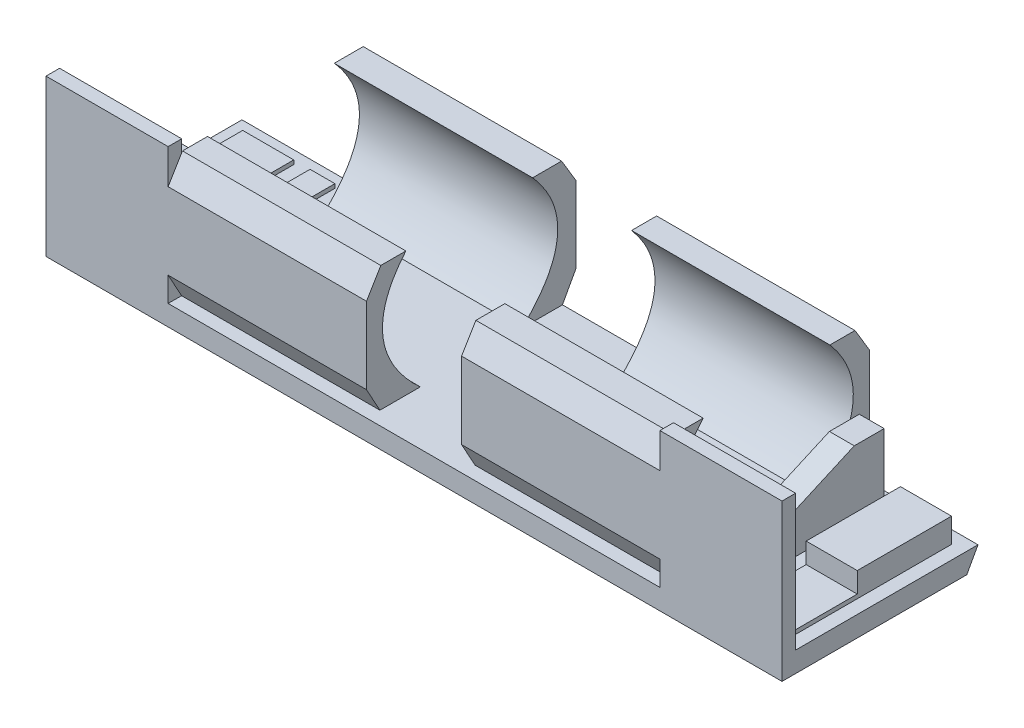
from build123d import *

# Parameters (mm, degrees)
SKETCH_1_W               = 3.76
SKETCH_1_H               = 11.54
SKETCH_1_W_2             = 1.83
SKETCH_1_W_3             = 14.6
SKETCH_1_H_2             = 2.72
SKETCH_1_H_3             = 6.9
EXTRUDE_1_DEPTH          = 1
SKETCH_1_3_W             = 3.76
SKETCH_1_3_H             = 11.54
SKETCH_1_3_W_2           = 1.83
SKETCH_1_3_W_3           = 14.6
SKETCH_1_3_H_2           = 2.72
EXTRUDE_2_DEPTH          = 10
EXTRUDE_3_DEPTH          = 14.6
CUT_EXTRUDE_1_DEPTH      = 14.6
CUT_EXTRUDE_2_DEPTH      = 14.6
CUT_EXTRUDE_3_DEPTH      = 14.6
PATTERN_CIRCULAR_1_COUNT = 2
SKETCH_7_W               = 20.64829466
SKETCH_7_H               = 2.860597992
CUT_EXTRUDE_4_DEPTH      = 38.6
SKETCH_8_W               = 54.18
SKETCH_8_H               = 19.048575036
SKETCH_8_W_2             = 7
SKETCH_8_H_2             = 4.5
SKETCH_8_R               = 1.6
EXTRUDE_4_DEPTH          = 1.5
SKETCH_9_W               = 54.18
SKETCH_9_H               = 1.8
EXTRUDE_5_DEPTH          = 7
SKETCH_10_R              = 1.65
CUT_EXTRUDE_5_DEPTH      = 5
EXTRUDE_START            = 2
SKETCH_8_3_W             = 7
SKETCH_8_3_H             = 4.5
SKETCH_8_3_R             = 1.6
EXTRUDE_6_DEPTH          = 2
SKETCH_11_W              = 54.18
SKETCH_11_H              = 6.653379434
CUT_EXTRUDE_6_DEPTH      = 5
CUT_EXTRUDE_7_DEPTH      = 54.18
SKETCH_13_W              = 8.99
SKETCH_13_H              = 1
EXTRUDE_7_DEPTH          = 10


with BuildPart() as part:
    # 草图1 → 凸台-拉伸1 (new body)
    # profile 1 of 6: a face of its own
    with BuildSketch(Plane(origin=(0, 0, 0), x_dir=(1, 0, 0), z_dir=(0, 1, 0))):
        Polygon((-7.603, 6.17), (-7.603, -6.17), (1.387, -6.17), (1.387, -3.45), (1.387, 3.45), (1.387, 6.17), align=None)
        with Locations((-4.723, 0)):
            Rectangle(SKETCH_1_W, SKETCH_1_H, mode=Mode.SUBTRACT)
        with Locations((-0.728, 0)):
            Rectangle(SKETCH_1_W_2, SKETCH_1_H, mode=Mode.SUBTRACT)
    # profile 2 of 6: a face of its own
    with BuildSketch(Plane(origin=(0, 0, 0), x_dir=(1, 0, 0), z_dir=(0, 1, 0))):
        with Locations((8.687, -4.81)):
            Rectangle(SKETCH_1_W_3, SKETCH_1_H_2)
    # profile 3 of 6: a face of its own
    with BuildSketch(Plane(origin=(0, 0, 0), x_dir=(1, 0, 0), z_dir=(0, 1, 0))):
        with Locations((8.687, 0)):
            Rectangle(SKETCH_1_W_3, SKETCH_1_H_3)
    # profile 4 of 6: a face of its own
    with BuildSketch(Plane(origin=(0, 0, 0), x_dir=(1, 0, 0), z_dir=(0, 1, 0))):
        with Locations((8.687, 4.81)):
            Rectangle(SKETCH_1_W_3, SKETCH_1_H_2)
    # profile 5 of 6: a face of its own
    with BuildSketch(Plane(origin=(0, 0, 0), x_dir=(1, 0, 0), z_dir=(0, 1, 0))):
        with Locations((-4.723, 0)):
            Rectangle(SKETCH_1_W, SKETCH_1_H)
    # profile 6 of 6: a face of its own
    with BuildSketch(Plane(origin=(0, 0, 0), x_dir=(1, 0, 0), z_dir=(0, 1, 0))):
        with Locations((-0.728, 0)):
            Rectangle(SKETCH_1_W_2, SKETCH_1_H)
    extrude(amount=-EXTRUDE_1_DEPTH)

    # 草图1<3> → 凸台-拉伸2 (add)
    with BuildSketch(Plane(origin=(0, 0, 0), x_dir=(1, 0, 0), z_dir=(0, 1, 0))):
        with Locations((-4.723, 0)):
            Rectangle(SKETCH_1_3_W, SKETCH_1_3_H)
        with Locations((-0.728, 0)):
            Rectangle(SKETCH_1_3_W_2, SKETCH_1_3_H)
        with Locations((8.687, -4.81)):
            Rectangle(SKETCH_1_3_W_3, SKETCH_1_3_H_2)
        with Locations((8.687, 4.81)):
            Rectangle(SKETCH_1_3_W_3, SKETCH_1_3_H_2)
    extrude(amount=EXTRUDE_2_DEPTH)

    # 草图4 → 凸台-拉伸3 (add)
    with BuildSketch(Plane(origin=(15.987, 0, 0), x_dir=(0, 0, -1), z_dir=(1, 0, 0))):
        Polygon((6.17, 10), (7.707580576, 7.443577481), (7.707580576, 1.805314446), (6.17, -1), align=None)
        Polygon((-7.707580576, 1.805314446), (-6.17, -1), (-6.17, 10), (-7.707580576, 7.443577481), align=None)
    extrude(amount=-EXTRUDE_3_DEPTH)

    # 草图3 → 切除-拉伸1 (cut)
    with BuildSketch(Plane(origin=(15.987, 0, 0), x_dir=(0, 0, -1), z_dir=(1, 0, 0))):
        with BuildLine():
            Line((3.45, 0), (3.743222721, 0))
            add(Edge.make_bspline(
                [(3.743222721, 0), (3.911611309, 0.15963804), (4.29393083, 0.539845441), (4.994683036, 1.333496486), (5.723480991, 2.402845903), (6.251271172, 3.695549278), (6.429364414, 5), (6.251271172, 6.304450722), (5.723480991, 7.597154097), (4.994683036, 8.666503514), (4.253106755, 9.506390689), (3.815688064, 9.935054209), (3.597380816, 10.136172737)],
                knots=[0.014828564, 0.014828564, 0.014828564, 0.014828564, 0.0625, 0.125, 0.25, 0.375, 0.5, 0.625, 0.75, 0.875, 0.9375, 0.998871937, 0.998871937, 0.998871937, 0.998871937], degree=3))
            Line((3.597380816, 10.136172737), (3.45, 10))
            Line((3.45, 10), (3.45, 0))
        make_face()
        with BuildLine():
            Line((-3.45, 0), (-3.743222721, 0))
            add(Edge.make_bspline(
                [(-3.743222721, 0), (-3.781981306, 0.035623699), (-3.849464206, 0.098316559), (-4.072000203, 0.30899054), (-4.461726475, 0.698324492), (-5.152564834, 1.48074741), (-5.881362789, 2.550096827), (-6.40915297, 3.842800202), (-6.587246212, 5.147250924), (-6.40915297, 6.451701646), (-5.881362789, 7.744405021), (-5.152564834, 8.813754438), (-4.461708764, 9.596197415), (-4.071967827, 9.985543512), (-3.84942965, 10.196217487), (-3.781968617, 10.258889811), (-3.743222721, 10.294501848)],
                knots=[0, 0, 0, 0, 0.010893382, 0.018155637, 0.0625, 0.125, 0.25, 0.375, 0.5, 0.625, 0.75, 0.875, 0.9375, 0.981850307, 0.989110184, 1, 1, 1, 1], degree=3))
            Line((-3.743222721, 10.294501848), (-3.45, 10))
            Line((-3.45, 10), (-3.45, 0))
        make_face()
    extrude(amount=-CUT_EXTRUDE_1_DEPTH, mode=Mode.SUBTRACT)

    # 草图5 → 切除-拉伸2 (cut)
    with BuildSketch(Plane(origin=(0.187, 0, 0), x_dir=(0, 0, -1), z_dir=(1, 0, 0))):
        Polygon((1.17, 2.8), (-3.569711506, 4.901860767), (-5.77, 4.901860767), (-5.77, 10), (5.77, 10), (5.77, 0.3), (1.17, 0.3), align=None)
    extrude(amount=-CUT_EXTRUDE_2_DEPTH, mode=Mode.SUBTRACT)

    # 草图6 → 切除-拉伸3 (cut)
    with BuildSketch(Plane(origin=(-2.843, 0, 0), x_dir=(0, 0, -1), z_dir=(1, 0, 0))):
        Polygon((1.17, 5.538552109), (1.17, 1.8), (-3.795527251, 1.8), (-5.77, 1.8), (-5.77, 5.538552109), align=None)
    extrude(amount=-CUT_EXTRUDE_3_DEPTH, mode=Mode.SUBTRACT)


with BuildPart() as pattern_circular_1_1:
    # 阵列(圆周)1: pattern copy
    add(part.part.rotate(Axis((19.487, -1.5500525, 0), (0, 1, 0)), 1 * 360 / PATTERN_CIRCULAR_1_COUNT))


with BuildPart() as cut_extrude_4_tool:
    # 草图7 → 切除-拉伸4 (new body)
    with BuildSketch(Plane.ZY.offset(-1.387)):
        with Locations((-0.112362095, 10.62761907)):
            Rectangle(SKETCH_7_W, SKETCH_7_H)
    extrude(amount=-CUT_EXTRUDE_4_DEPTH)


with BuildPart() as part_1:
    add(part.part)

    # 切除-拉伸4: cut by cut_extrude_4_tool
    add(cut_extrude_4_tool.part, mode=Mode.SUBTRACT)



with BuildPart() as pattern_circular_1_1_1:
    add(pattern_circular_1_1.part)

    # 切除-拉伸4: cut by cut_extrude_4_tool
    add(cut_extrude_4_tool.part, mode=Mode.SUBTRACT)


with BuildPart() as part_2:
    add(part_1.part)

    add(pattern_circular_1_1_1.part)  # 凸台-拉伸4 merges 阵列(圆周)1_1
    # 草图8 → 凸台-拉伸4 (add)
    # profile 1 of 2: a face of its own
    with BuildSketch(Plane(origin=(0, 0, 0), x_dir=(1, 0, 0), z_dir=(0, 1, 0))):
        with Locations((19.487, 0)):
            Rectangle(SKETCH_8_W, SKETCH_8_H)
    # profile 2 of 2: a face of its own
    with BuildSketch(Plane(origin=(0, 0, 0), x_dir=(1, 0, 0), z_dir=(0, 1, 0))):
        with Locations((19.487, -11.774287518)):
            Rectangle(SKETCH_8_W_2, SKETCH_8_H_2)
        with Locations(Location((19.487, -11.774287518, 0), (0, 0, 270))):
            Circle(SKETCH_8_R, mode=Mode.SUBTRACT)
    extrude(amount=-EXTRUDE_4_DEPTH)

    # 草图9 → 凸台-拉伸5 (add)
    with BuildSketch(Plane(origin=(0, 0, 0), x_dir=(1, 0, 0), z_dir=(0, 1, 0))):
        with Locations((19.487, 8.624287518)):
            Rectangle(SKETCH_9_W, SKETCH_9_H)
    extrude(amount=EXTRUDE_5_DEPTH)

    # 草图10 → 切除-拉伸5 (cut)
    with BuildSketch(Plane.XY.offset(-7.724287518)):
        with Locations((-4.603, 2.5)):
            Circle(SKETCH_10_R)
        with Locations((43.577, 2.5)):
            Circle(SKETCH_10_R)
    extrude(amount=-CUT_EXTRUDE_5_DEPTH, mode=Mode.SUBTRACT)

    # 草图8<3> → 凸台-拉伸6 (add)
    with BuildSketch(Plane(origin=(0, 0, 0), x_dir=(1, 0, 0), z_dir=(0, 1, 0)).offset(EXTRUDE_START)):
        with Locations((19.487, -11.774287518)):
            Rectangle(SKETCH_8_3_W, SKETCH_8_3_H)
        with Locations(Location((19.487, -11.774287518, 0), (0, 0, 270))):
            Circle(SKETCH_8_3_R, mode=Mode.SUBTRACT)
    extrude(amount=-EXTRUDE_6_DEPTH)

    # 草图11 → 切除-拉伸6 (cut, symmetric)
    with BuildSketch(Plane(origin=(0, 0, 0), x_dir=(1, 0, 0), z_dir=(0, 1, 0))):
        with Locations((19.487, -11.034270293)):
            Rectangle(SKETCH_11_W, SKETCH_11_H)
    extrude(amount=CUT_EXTRUDE_6_DEPTH, both=True, mode=Mode.SUBTRACT)

    # 草图12 → 切除-拉伸7 (cut)
    with BuildSketch(Plane(origin=(46.577, 0, 0), x_dir=(0, 0, -1), z_dir=(1, 0, 0))):
        Polygon((7.707580576, 1.805314446), (5.895952187, -1.5), (9.524287518, -1.5), (9.524287518, 7.146168792), (7.724287518, 7), align=None)
    extrude(amount=-CUT_EXTRUDE_7_DEPTH, mode=Mode.SUBTRACT)

    # 草图13 → 凸台-拉伸7 (add)
    with BuildSketch(Plane(origin=(0, 0, 0), x_dir=(1, 0, 0), z_dir=(0, 1, 0))):
        with Locations((42.082, -7.207580576)):
            Rectangle(SKETCH_13_W, SKETCH_13_H)
        with Locations((-3.108, -7.207580576)):
            Rectangle(SKETCH_13_W, SKETCH_13_H)
    extrude(amount=EXTRUDE_7_DEPTH)


solid = part_2.part
